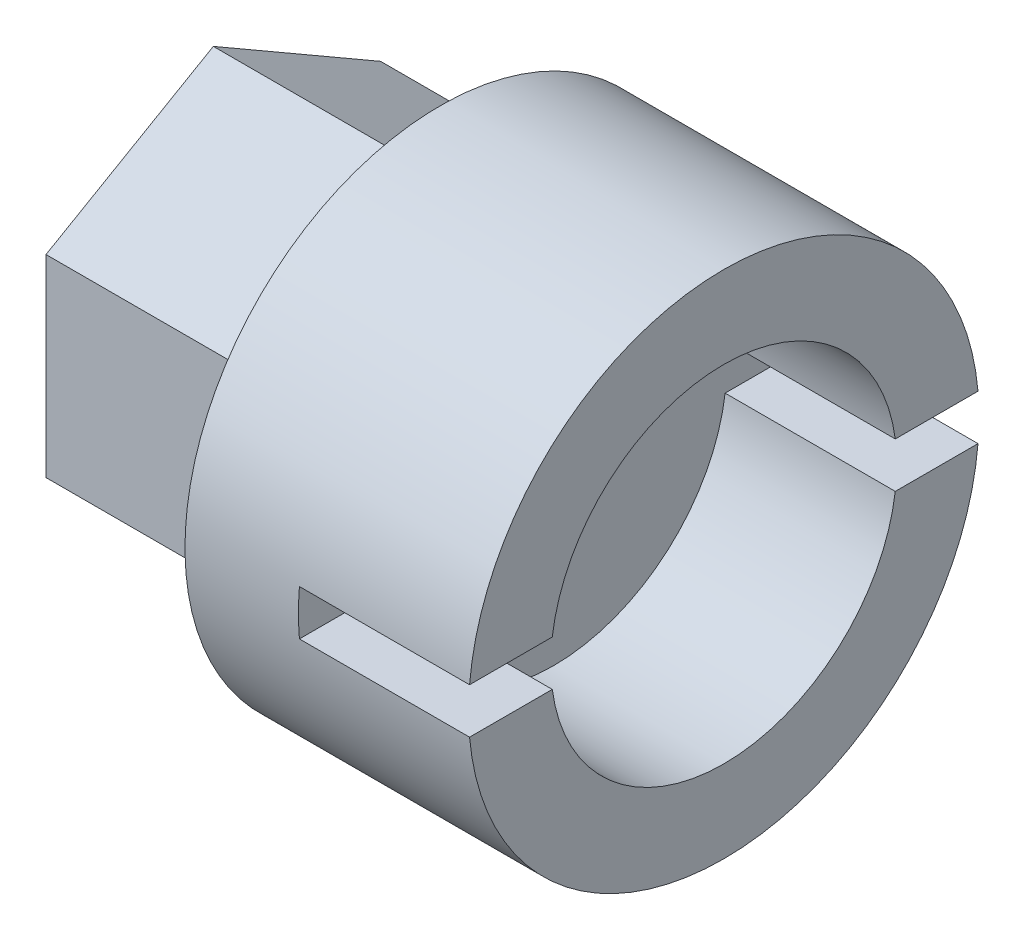
from build123d import *

# Parameters (mm, degrees)
BOSS_EXTRUDE1_DEPTH = 4
SKETCH2_R           = 4.5
BOSS_EXTRUDE2_DEPTH = 2
SKETCH3_R           = 4.5
SKETCH3_R_2         = 3.05
BOSS_EXTRUDE3_DEPTH = 3
SKETCH4_W           = 0.8
SKETCH4_H           = 3
CUT_EXTRUDE1_DEPTH  = 5


with BuildPart() as part:
    # Sketch1 → Boss-Extrude1 (new body)
    with BuildSketch(Plane.YZ):
        Polygon((1.703183294, -2.95), (3.406366588, 0), (1.703183294, 2.95), (-1.703183294, 2.95), (-3.406366588, 0), (-1.703183294, -2.95), align=None)
    extrude(amount=BOSS_EXTRUDE1_DEPTH)

    # Sketch2 → Boss-Extrude2 (add)
    with BuildSketch(Plane.YZ.offset(4)):
        with Locations(Location((0, 0, 0), (0, 0, 270))):
            Circle(SKETCH2_R)
    extrude(amount=BOSS_EXTRUDE2_DEPTH)

    # Sketch3 → Boss-Extrude3 (add)
    with BuildSketch(Plane.YZ.offset(6)):
        with Locations(Location((0, 0, 0), (0, 0, 270))):
            Circle(SKETCH3_R)
        with Locations(Location((0, 0, 0), (0, 0, 270))):
            Circle(SKETCH3_R_2, mode=Mode.SUBTRACT)
    extrude(amount=BOSS_EXTRUDE3_DEPTH)

    # Sketch4 → Cut-Extrude1 (cut, symmetric)
    with BuildSketch(Plane(origin=(0, 0, 0), x_dir=(0, 1, 0), z_dir=(0, 0, 1))):
        with Locations((0, -7.5)):
            Rectangle(SKETCH4_W, SKETCH4_H)
    extrude(amount=CUT_EXTRUDE1_DEPTH, both=True, mode=Mode.SUBTRACT)


solid = part.part
